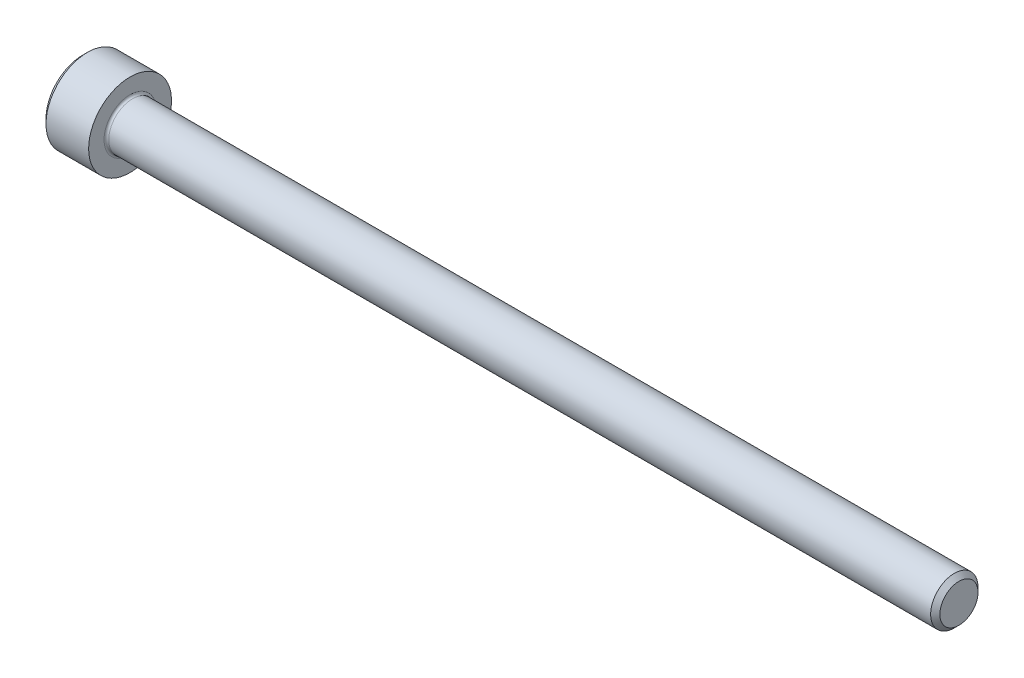
from build123d import *

# Parameters (mm, degrees)
FILLET1_R   = 0.2
HEX_2_DEPTH = 2


with BuildPart() as part:
    # BodySke → Base-Revolve (revolve)
    with BuildSketch(Plane.XY, mode=Mode.PRIVATE) as base_revolve_sk:
        Polygon((0, 0), (0, 3.1), (0.4, 3.5), (4, 3.5), (4, 2), (73.61, 2), (74, 1.61), (74, 0), align=None)
    revolve(base_revolve_sk.sketch.rotate(Axis((-31.75, 0, 0), (1, 0, 0)), 90), axis=Axis((-31.75, 0, 0), (1, 0, 0)))

    # Fillet1
    fillet1_edges = [part.edges().sort_by_distance(p)[0] for p in [
        (4, 0, -2),
    ]]
    fillet(fillet1_edges, radius=FILLET1_R)

    # Sketch2 → Hex-PreBroach (revolve, cut)
    with BuildSketch(Plane.XY, mode=Mode.PRIVATE) as hex_prebroach_sk:
        Polygon((0, 1.5355), (2, 1.5355), (2.886521338, 0), (0, 0), align=None)
    revolve(hex_prebroach_sk.sketch.rotate(Axis((0, 0, 0), (1, 0, 0)), 90), axis=Axis((0, 0, 0), (1, 0, 0)), mode=Mode.SUBTRACT)

    # Sketch3 → Hex 2 (cut)
    with BuildSketch(Plane(origin=(0, 0, 0), x_dir=(0, 0.500000000000001, 0.866025403784438), z_dir=(-1, 0, 0))):
        Polygon((0.886521338, 1.5355), (-0.886521338, 1.5355), (-1.773042677, 0), (-0.886521338, -1.5355), (0.886521338, -1.5355), (1.773042677, 0), align=None)
    extrude(amount=-HEX_2_DEPTH, mode=Mode.SUBTRACT)


solid = part.part
